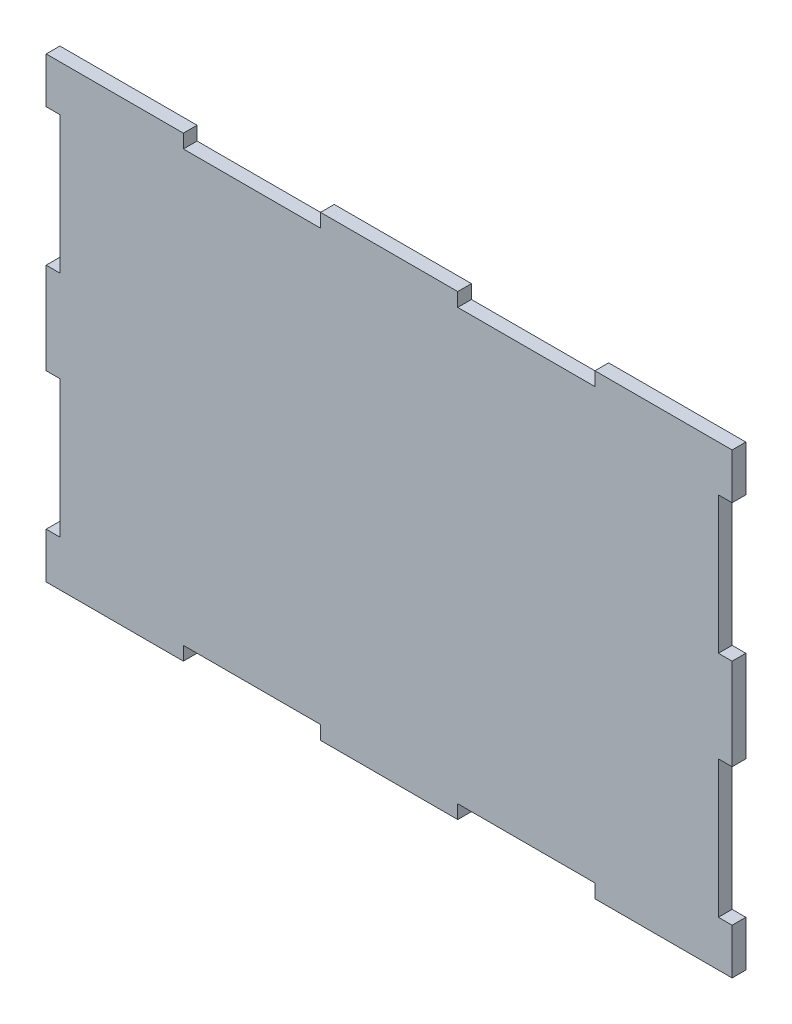
from build123d import *

# Parameters (mm, degrees)
BOSS_EXTRU_1_DEPTH = 3


with BuildPart() as part:
    # Esquisse1 → Boss.-Extru.1 (new body)
    with BuildSketch(Plane.XY):
        Polygon((18.415978925, 28.019661458), (48.415978925, 28.019661458), (48.415978925, 25.019661458), (78.415978925, 25.019661458), (78.415978925, 28.019661458), (108.415978925, 28.019661458), (108.415978925, 18.019661458), (105.415978925, 18.019661458), (105.415978925, -11.980338542), (108.415978925, -11.980338542), (108.415978925, -31.980338542), (105.415978925, -31.980338542), (105.415978925, -61.980338542), (108.415978925, -61.980338542), (108.415978925, -71.980338542), (78.415978925, -71.980338542), (78.415978925, -68.980338542), (48.415978925, -68.980338542), (48.415978925, -71.980338542), (18.415978925, -71.980338542), (18.415978925, -68.980338542), (-11.584021075, -68.980338542), (-11.584021075, -71.980338542), (-41.584021075, -71.980338542), (-41.584021075, -61.980338542), (-38.584021075, -61.980338542), (-38.584021075, -31.980338542), (-41.584021075, -31.980338542), (-41.584021075, -11.980338542), (-38.584021075, -11.980338542), (-38.584021075, 18.019661458), (-41.584021075, 18.019661458), (-41.584021075, 28.019661458), (-11.584021075, 28.019661458), (-11.584021075, 25.019661458), (18.415978925, 25.019661458), align=None)
    extrude(amount=BOSS_EXTRU_1_DEPTH)


solid = part.part
